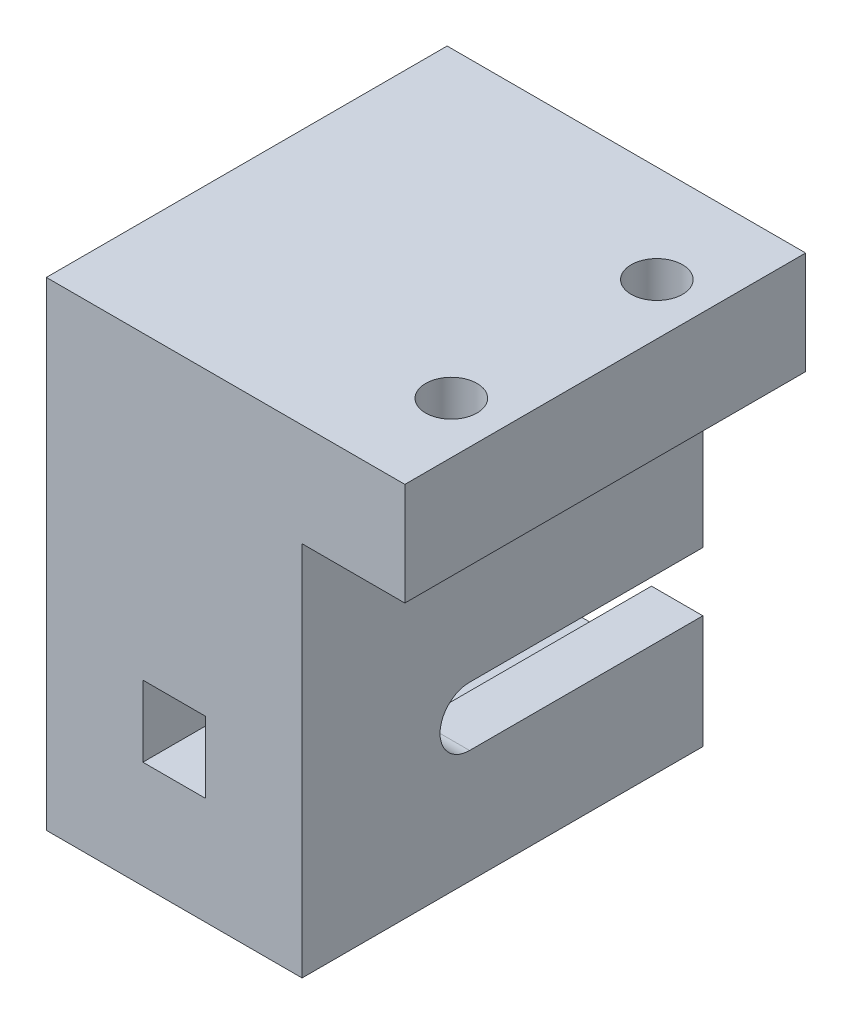
from build123d import *

# Parameters (mm, degrees)
SKETCH1_W                = 31.6
SKETCH1_H                = 35.300000012
SKETCH1_W_2              = 18.9
SKETCH1_H_2              = 22.600000012
BOSS_EXTRUDE1_DEPTH      = 40
SKETCH2_W                = 31.6
SKETCH2_H                = 35.300000012
SKETCH2_W_2              = 18.9
SKETCH2_H_2              = 22.600000012
BOSS_EXTRUDE2_DEPTH      = 9.525
SKETCH3_W                = 7.74908697
SKETCH3_H                = 8.788598638
CUT_EXTRUDE1_DEPTH       = 12.7
CUT_EXTRUDE2_DEPTH       = 31.75
SKETCH6_W                = 31.6
SKETCH6_H                = 49.525
BOSS_EXTRUDE3_DEPTH      = 11.176
BOSS_EXTRUDE4_DEPTH      = 12.7
BOSS_EXTRUDE4_DEPTH_BACK = 44.45
SKETCH7_W                = 49.525
SKETCH7_H                = 6.35
SKETCH8_R                = 3.175
SKETCH8_R_2              = 3.429
CUT_EXTRUDE3_DEPTH       = 6.35
SKETCH9_W                = 12.85
SKETCH9_H                = 49.525
CUT_EXTRUDE4_DEPTH       = 6.35
SKETCH10_R               = 6.35
CUT_EXTRUDE5_DEPTH       = 6.35
SKETCH11_W               = 44.3
SKETCH11_H               = 49.525
SKETCH11_R               = 3.175
BOSS_EXTRUDE5_DEPTH      = 12.7
SKETCH12_W               = 12.7
SKETCH12_H               = 49.525
SKETCH12_R               = 3.175
CUT_EXTRUDE6_DEPTH       = 6.35


with BuildPart() as part:
    # Sketch1 → Boss-Extrude1 (new body)
    with BuildSketch(Plane.XY):
        Rectangle(SKETCH1_W, SKETCH1_H)
        Rectangle(SKETCH1_W_2, SKETCH1_H_2, mode=Mode.SUBTRACT)
    extrude(amount=BOSS_EXTRUDE1_DEPTH)

    # Sketch2 → Boss-Extrude2 (add)
    # profile 1 of 2: a face of its own
    with BuildSketch(Plane.XY.offset(40)):
        Rectangle(SKETCH2_W, SKETCH2_H)
        Rectangle(SKETCH2_W_2, SKETCH2_H_2, mode=Mode.SUBTRACT)
    # profile 2 of 2: a face of its own
    with BuildSketch(Plane.XY.offset(40)):
        Rectangle(SKETCH2_W_2, SKETCH2_H_2)
    extrude(amount=BOSS_EXTRUDE2_DEPTH)

    # Sketch3 → Cut-Extrude1 (cut)
    with BuildSketch(Plane(origin=(0, 0, 40), x_dir=(-1, 0, 0), z_dir=(0, 0, -1))):
        Rectangle(SKETCH3_W, SKETCH3_H)
    extrude(amount=-CUT_EXTRUDE1_DEPTH, mode=Mode.SUBTRACT)

    # Sketch5 → Cut-Extrude2 (cut)
    with BuildSketch(Plane(origin=(15.8, 0, 0), x_dir=(0, 0, -1), z_dir=(1, 0, 0))):
        with BuildLine():
            Line((-28.827575985, 3.65), (0, 3.65))
            Line((0, 3.65), (0, -3.65))
            Line((0, -3.65), (-28.827575985, -3.65))
            ThreePointArc((-28.827575985, -3.65), (-32.477575985, 0), (-28.827575985, 3.65))
        make_face()
    extrude(amount=-CUT_EXTRUDE2_DEPTH, mode=Mode.SUBTRACT)

    # Sketch6 → Boss-Extrude3 (add)
    with BuildSketch(Plane(origin=(0, 17.650000006, 0), x_dir=(1, 0, 0), z_dir=(0, 1, 0))):
        with Locations((0, -24.7625)):
            Rectangle(SKETCH6_W, SKETCH6_H)
    extrude(amount=BOSS_EXTRUDE3_DEPTH)

    # Sketch7 → Boss-Extrude4 (add, two sides: drawn at the far end of the back side and taken through both)
    with BuildSketch(Plane(origin=(15.8, 0, 0), x_dir=(0, 0, -1), z_dir=(1, 0, 0)).offset(-BOSS_EXTRUDE4_DEPTH_BACK)):
        with Locations((-24.7625, 25.651000006)):
            Rectangle(SKETCH7_W, SKETCH7_H)
    extrude(amount=BOSS_EXTRUDE4_DEPTH + BOSS_EXTRUDE4_DEPTH_BACK)

    # Sketch8 → Cut-Extrude3 (cut)
    with BuildSketch(Plane.XZ.offset(-22.476000006)):
        with Locations(Location((-22.225, 24.7625, 0), (0, 0, 270))):
            Circle(SKETCH8_R)
        with Locations(Location((22.15, 37.434572452, 0), (0, 0, 270))):
            Circle(SKETCH8_R_2)
        with Locations(Location((22.15, 12.034572452, 0), (0, 0, 270))):
            Circle(SKETCH8_R_2)
    extrude(amount=-CUT_EXTRUDE3_DEPTH, mode=Mode.SUBTRACT)

    # Sketch9 → Cut-Extrude4 (cut)
    with BuildSketch(Plane.XZ.offset(-22.476000006)):
        with Locations((-22.225, 24.7625)):
            Rectangle(SKETCH9_W, SKETCH9_H)
    extrude(amount=-CUT_EXTRUDE4_DEPTH, mode=Mode.SUBTRACT)

    # Sketch10 → Cut-Extrude5 (cut)
    with BuildSketch(Plane.ZY.offset(15.8)):
        with Locations((28.827575985, 0)):
            Circle(SKETCH10_R)
    extrude(amount=-CUT_EXTRUDE5_DEPTH, mode=Mode.SUBTRACT)

    # Sketch11 → Boss-Extrude5 (add)
    with BuildSketch(Plane(origin=(0, 28.826000006, 0), x_dir=(1, 0, 0), z_dir=(0, 1, 0))):
        with Locations((6.35, -24.7625)):
            Rectangle(SKETCH11_W, SKETCH11_H)
        with Locations(Location((22.15, -12.034572452, 0), (0, 0, 270))):
            Circle(SKETCH11_R, mode=Mode.SUBTRACT)
        with Locations(Location((22.15, -37.434572452, 0), (0, 0, 270))):
            Circle(SKETCH11_R, mode=Mode.SUBTRACT)
    extrude(amount=BOSS_EXTRUDE5_DEPTH)

    # Sketch12 → Cut-Extrude6 (cut)
    with BuildSketch(Plane.XZ.offset(-22.476000006)):
        with Locations((22.15, 24.7625)):
            Rectangle(SKETCH12_W, SKETCH12_H)
        with Locations(Location((22.15, 37.434572452, 0), (0, 0, 90))):
            Circle(SKETCH12_R, mode=Mode.SUBTRACT)
        with Locations(Location((22.15, 12.034572452, 0), (0, 0, 90))):
            Circle(SKETCH12_R, mode=Mode.SUBTRACT)
    extrude(amount=-CUT_EXTRUDE6_DEPTH, mode=Mode.SUBTRACT)


solid = part.part
